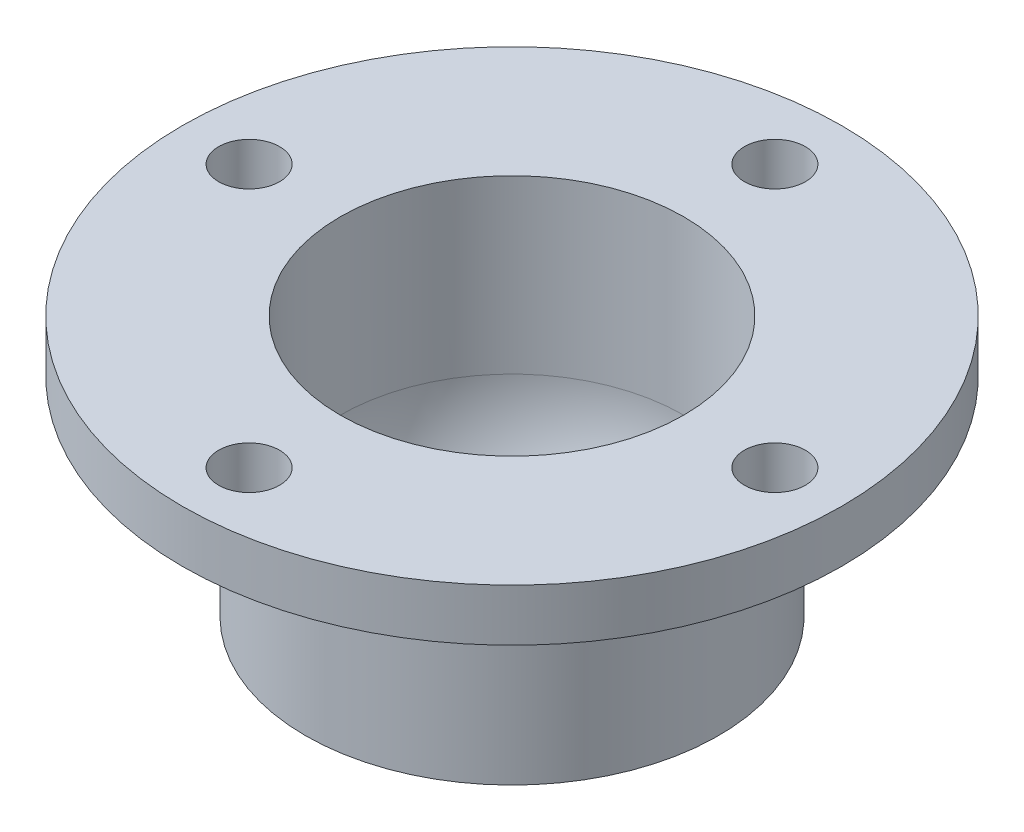
from build123d import *

# Parameters (mm, degrees)
SKETCH1_R           = 11.9
SKETCH1_R_2         = 9.9
BOSS_EXTRUDE3_DEPTH = 15
SKETCH4_R           = 9.9
BOSS_EXTRUDE4_DEPTH = 5.1
BOSS_EXTRUDE8_START = -3
SKETCH12_R          = 19
SKETCH12_R_2        = 11.9
BOSS_EXTRUDE8_DEPTH = 3
SKETCH14_R          = 1.755
CUT_EXTRUDE4_DEPTH  = 3


with BuildPart() as part:
    # Sketch1 → Boss-Extrude3 (new body)
    with BuildSketch(Plane(origin=(0, 0, 0), x_dir=(1, 0, 0), z_dir=(0, 1, 0))):
        with Locations(Location((0, 0, 0), (0, 0, 270))):
            Circle(SKETCH1_R)
        with Locations(Location((0, 0, 0), (0, 0, 270))):
            Circle(SKETCH1_R_2, mode=Mode.SUBTRACT)
    extrude(amount=BOSS_EXTRUDE3_DEPTH)

    # Sketch4 → Boss-Extrude4 (add)
    with BuildSketch(Plane.XZ):
        with Locations(Location((0, 0, 0), (0, 0, 270))):
            Circle(SKETCH4_R)
    extrude(amount=-BOSS_EXTRUDE4_DEPTH)

    # Sketch7 → Cut-Revolve2 (revolve, cut)
    with BuildSketch(Plane(origin=(0, 0, 0), x_dir=(0, 0, -1), z_dir=(1, 0, 0))):
        with BuildLine():
            Line((0, 15), (0, -4.8))
            ThreePointArc((0, -4.8), (9.9, 5.1), (0, 15))
        make_face()
    revolve(axis=Axis((0, 15, 0), (0, -1, 0)), mode=Mode.SUBTRACT)

    # Sketch12 → Boss-Extrude8 (add)
    with BuildSketch(Plane(origin=(0, 15, 0), x_dir=(1, 0, 0), z_dir=(0, 1, 0)).offset(BOSS_EXTRUDE8_START)):
        with Locations(Location((0, 0, 0), (0, 0, 270))):
            Circle(SKETCH12_R)
        with Locations(Location((0, 0, 0), (0, 0, 270))):
            Circle(SKETCH12_R_2, mode=Mode.SUBTRACT)
    extrude(amount=BOSS_EXTRUDE8_DEPTH)

    # Sketch14 → Cut-Extrude4 (cut)
    with BuildSketch(Plane(origin=(0, 15, 0), x_dir=(1, 0, 0), z_dir=(0, 1, 0))):
        with Locations(Location((0, 15.15, 0), (0, 0, 270))):
            Circle(SKETCH14_R)
        with Locations(Location((-15.15, 0, 0), (0, 0, 270))):
            Circle(SKETCH14_R)
        with Locations(Location((0, -15.15, 0), (0, 0, 270))):
            Circle(SKETCH14_R)
        with Locations(Location((15.15, 0, 0), (0, 0, 270))):
            Circle(SKETCH14_R)
    extrude(amount=-CUT_EXTRUDE4_DEPTH, mode=Mode.SUBTRACT)


solid = part.part
